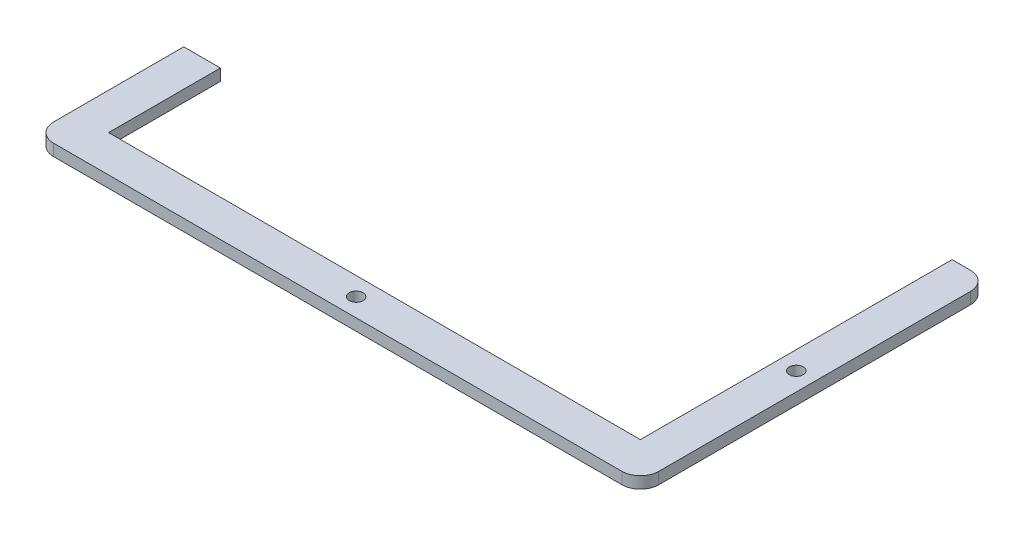
from build123d import *

# Parameters (mm, degrees)
SKETCH1_R           = 1.875
BOSS_EXTRUDE1_DEPTH = 3.175


with BuildPart() as part:
    # Sketch1 → Boss-Extrude1 (new body)
    with BuildSketch(Plane(origin=(0, 0, 0), x_dir=(1, 0, 0), z_dir=(0, 1, 0))):
        with BuildLine():
            Line((-5, 0), (-160, 0))
            ThreePointArc((-160, 0), (-163.535533906, 1.464466094), (-165, 5))
            Line((-165, 5), (-165, 40.5))
            Line((-165, 40.5), (-155, 40.5))
            Line((-155, 40.5), (-155, 10))
            Line((-155, 10), (-10, 10))
            Line((-10, 10), (-10, 85))
            Line((-10, 85), (-10, 95))
            Line((-10, 95), (-5, 95))
            ThreePointArc((-5, 95), (-1.464466094, 93.535533906), (0, 90))
            Line((0, 90), (0, 5))
            ThreePointArc((0, 5), (-1.464466094, 1.464466094), (-5, 0))
        make_face()
        with Locations(Location((-5, 47.5, 0), (0, 0, 270))):
            Circle(SKETCH1_R, mode=Mode.SUBTRACT)
        with Locations(Location((-82.5, 5, 0), (0, 0, 270))):
            Circle(SKETCH1_R, mode=Mode.SUBTRACT)
    extrude(amount=BOSS_EXTRUDE1_DEPTH)


solid = part.part
